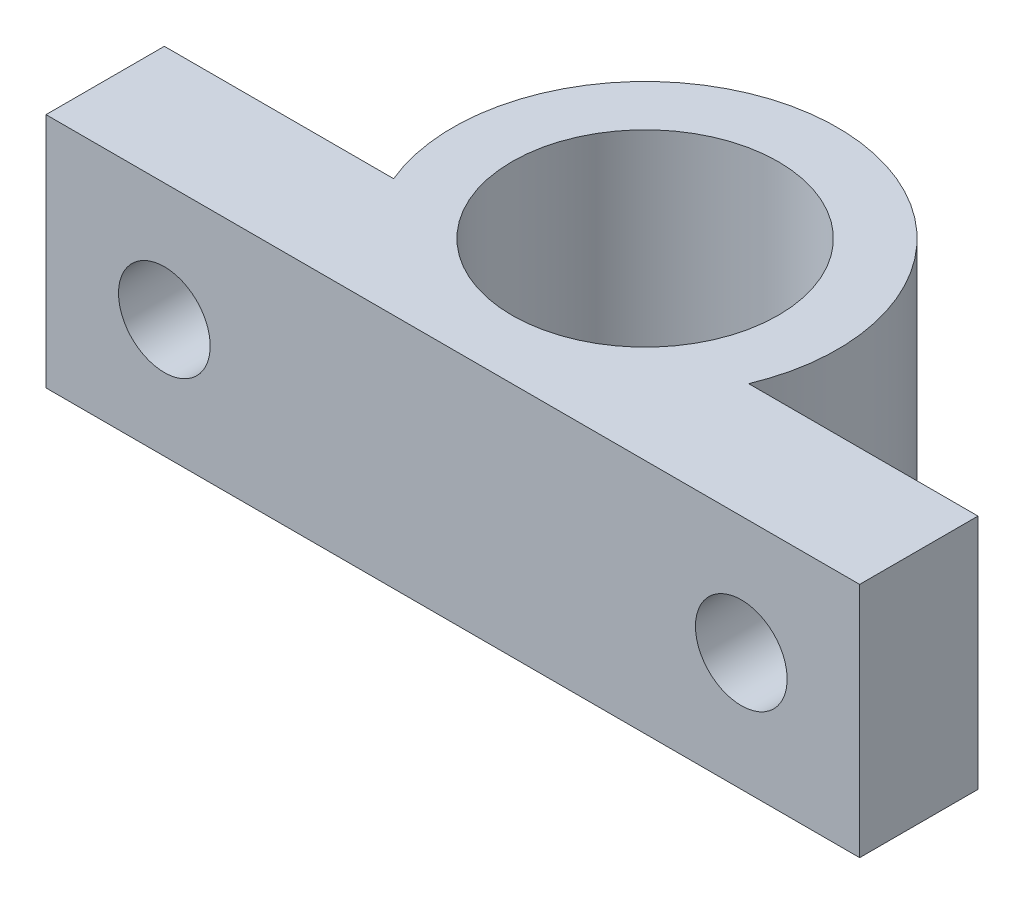
from build123d import *

# Parameters (mm, degrees)
SKETCH1_R           = 6.5
BOSS_EXTRUDE1_DEPTH = 8
SKETCH3_W           = 27.5
SKETCH3_H           = 8
BOSS_EXTRUDE2_DEPTH = 4
CUT_EXTRUDE1_REACH  = 19.185
SKETCH4_R           = 4.5
CUT_EXTRUDE2_REACH  = 20.277
SKETCH5_R           = 1.55


with BuildPart() as part:
    # Sketch1 → Boss-Extrude1 (new body)
    with BuildSketch(Plane(origin=(0, 0, 0), x_dir=(1, 0, 0), z_dir=(0, 1, 0))):
        with Locations(Location((0, 0, 0), (0, 0, 270))):
            Circle(SKETCH1_R)
    extrude(amount=BOSS_EXTRUDE1_DEPTH)

    # Sketch3 → Boss-Extrude2 (add)
    with BuildSketch(Plane(origin=(0, 8, 6.5), x_dir=(1, 0, 0), z_dir=(0, 0, 1))):
        with Locations((0, -4)):
            Rectangle(SKETCH3_W, SKETCH3_H)
    extrude(amount=-BOSS_EXTRUDE2_DEPTH)

    # Sketch4 → Cut-Extrude1 (cut, up to next)
    with BuildSketch(Plane(origin=(0, 8, 0), x_dir=(1, 0, 0), z_dir=(0, 1, 0)), mode=Mode.PRIVATE) as cut_extrude1_sk1:
        with Locations(Location((0, 0, 0), (0, 0, 270))):
            Circle(SKETCH4_R)
    cut_extrude1_tool1 = extrude(cut_extrude1_sk1.sketch, amount=-CUT_EXTRUDE1_REACH, mode=Mode.PRIVATE) & part.part
    add(cut_extrude1_tool1.solids().sort_by_distance((0, 8, 0))[0], mode=Mode.SUBTRACT)

    # Sketch5 → Cut-Extrude2 (cut, up to next)
    with BuildSketch(Plane(origin=(0, 0, 2.5), x_dir=(-1, 0, 0), z_dir=(0, 0, -1)), mode=Mode.PRIVATE) as cut_extrude2_sk1:
        with Locations((9.75, 4)):
            Circle(SKETCH5_R)
    cut_extrude2_tool1 = extrude(cut_extrude2_sk1.sketch, amount=-CUT_EXTRUDE2_REACH, mode=Mode.PRIVATE) & part.part
    # Sketch5 → Cut-Extrude2 (cut, up to next)
    with BuildSketch(Plane(origin=(0, 0, 2.5), x_dir=(-1, 0, 0), z_dir=(0, 0, -1)), mode=Mode.PRIVATE) as cut_extrude2_sk2:
        with Locations((-9.75, 4)):
            Circle(SKETCH5_R)
    cut_extrude2_tool2 = extrude(cut_extrude2_sk2.sketch, amount=-CUT_EXTRUDE2_REACH, mode=Mode.PRIVATE) & part.part
    add(cut_extrude2_tool1.solids().sort_by_distance((-9.75, 4, 2.5))[0], mode=Mode.SUBTRACT)
    add(cut_extrude2_tool2.solids().sort_by_distance((9.75, 4, 2.5))[0], mode=Mode.SUBTRACT)


solid = part.part
